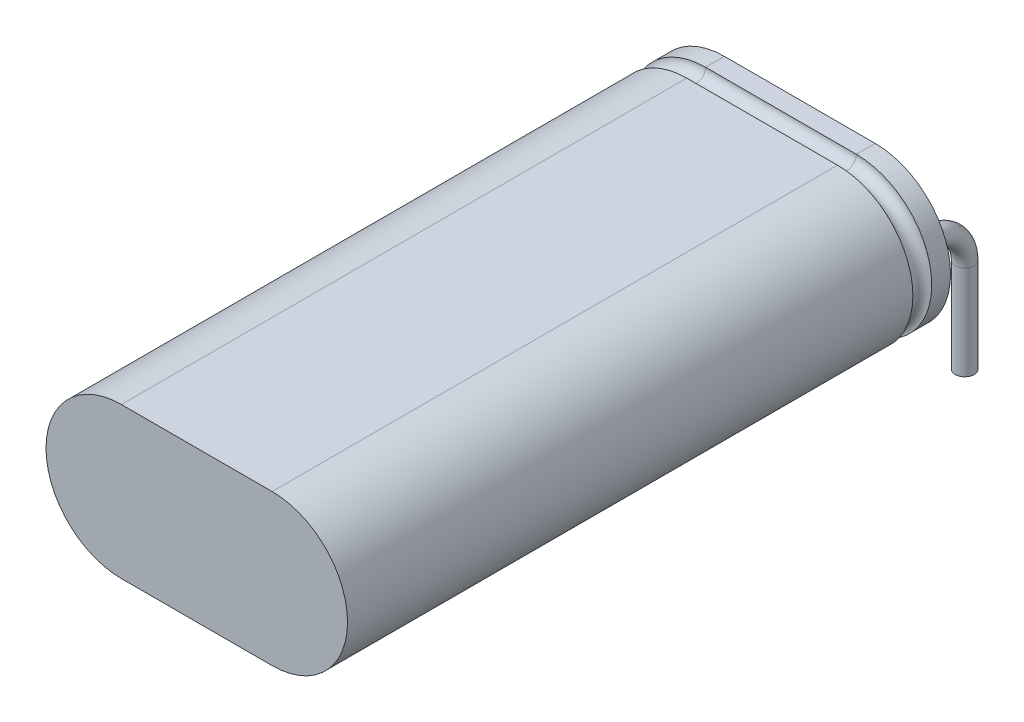
from build123d import *

# Parameters (mm, degrees)
REVOLVE1_ANGLE      = 180
BOSS_EXTRUDE2_DEPTH = 8
REVOLVE2_ANGLE      = 180
SWEEP1_PROFILE_R    = 0.5
SWEEP2_PROFILE_R    = 0.5


with BuildPart() as part:
    # Sketch3 → Revolve1 (revolve)
    with BuildSketch(Plane(origin=(0, 0, 0), x_dir=(0, 0, -1), z_dir=(1, 0, 0))):
        with BuildLine():
            Line((-32, 4), (-2, 4))
            ThreePointArc((-2, 4), (-1.5, 3.5), (-1, 4))
            Line((-1, 4), (0, 4))
            Line((0, 4), (0, 0))
            Line((0, 0), (-32, 0))
            Line((-32, 0), (-32, 4))
        make_face()
    revolve(axis=Axis((0, 0, 32.603933811), (0, 0, -1)), revolution_arc=REVOLVE1_ANGLE)

    # Sketch4 → Boss-Extrude2 (add)
    with BuildSketch(Plane.ZY):
        with BuildLine():
            Line((0, 4), (0, -4))
            Line((0, -4), (1, -4))
            ThreePointArc((1, -4), (1.5, -3.5), (2, -4))
            Line((2, -4), (32, -4))
            Line((32, -4), (32, 4))
            Line((32, 4), (2, 4))
            ThreePointArc((2, 4), (1.5, 3.5), (1, 4))
            Line((1, 4), (0, 4))
        make_face()
    extrude(amount=BOSS_EXTRUDE2_DEPTH)

    # Sketch5 → Revolve2 (revolve)
    with BuildSketch(Plane.ZY.offset(8)):
        with BuildLine():
            Line((0, 0), (0, 4))
            Line((0, 4), (1, 4))
            ThreePointArc((1, 4), (1.5, 3.5), (2, 4))
            Line((2, 4), (32, 4))
            Line((32, 4), (32, 0))
            Line((32, 0), (0, 0))
        make_face()
    revolve(axis=Axis((-8, 0, -3.043909687), (0, 0, 1)), revolution_arc=REVOLVE2_ANGLE)

    # Sweep1: sweep along a path in Sketch7
    with BuildLine(Plane(origin=(1.75, 0, 0), x_dir=(0, 0, -1), z_dir=(1, 0, 0))) as sweep1_path:
        Line((0, 0), (1, 0))
        ThreePointArc((1, 0), (2.414213562, -0.585786438), (3, -2))
        Line((3, -2), (3, -7))
    # Sweep1 profile (on start of the path) → Sweep1 (sweep)
    with BuildSketch(Plane(origin=(1.75, 0, 0), x_dir=(-1, 0, 0), z_dir=(0, 0, -1))):
        Circle(SWEEP1_PROFILE_R)
    sweep(path=sweep1_path.line)

    # Sweep2: sweep along a path in Sketch14
    with BuildLine(Plane.ZY.offset(9.75)) as sweep2_path:
        Line((0, 0), (-1, 0))
        ThreePointArc((-1, 0), (-2.414213562, -0.585786438), (-3, -2))
        Line((-3, -2), (-3, -7))
    # Sweep2 profile (on start of the path) → Sweep2 (sweep)
    with BuildSketch(Plane(origin=(-9.75, 0, 0), x_dir=(0, -1, 0), z_dir=(0, 0, -1))):
        Circle(SWEEP2_PROFILE_R)
    sweep(path=sweep2_path.line)


solid = part.part
